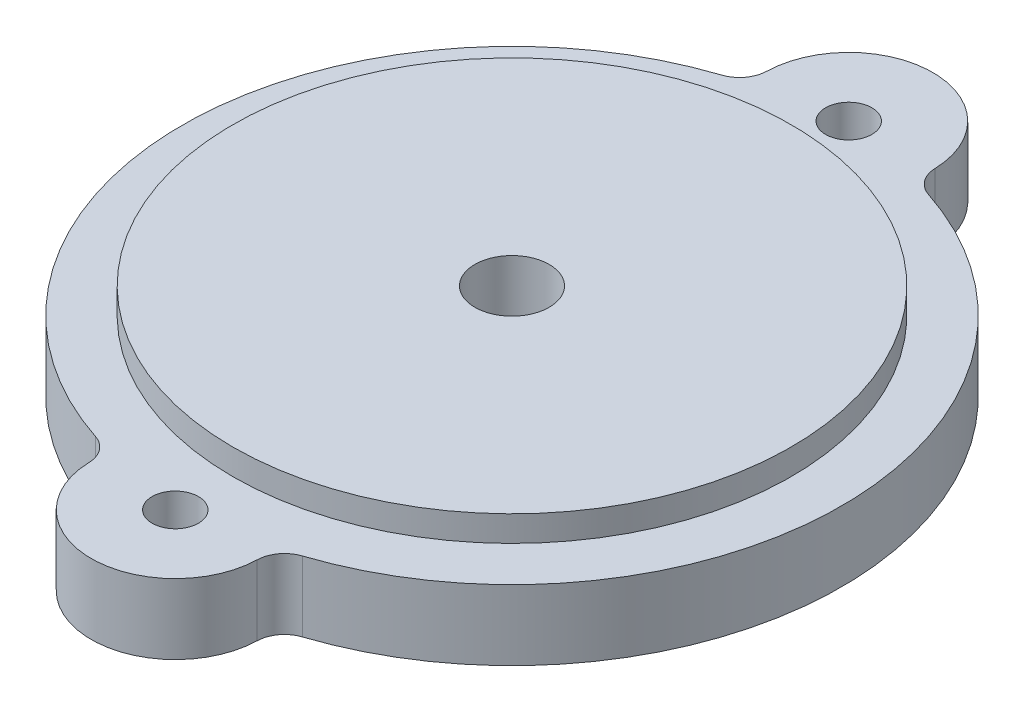
from build123d import *

# Parameters (mm, degrees)
SKETCH1_W           = 60
SKETCH1_H           = 60
SKETCH1_R           = 1.65
BOSS_EXTRUDE1_DEPTH = 5
SKETCH2_R           = 19.9
BOSS_EXTRUDE2_DEPTH = 1.83
SKETCH3_OUTSIDE_W   = 79.026
SKETCH3_OUTSIDE_H   = 79.026
CUT_EXTRUDE1_DEPTH  = 43.720018727
SKETCH4_R           = 2.65
CUT_EXTRUDE2_DEPTH  = 39.715615713
FILLET1_R           = 2


with BuildPart() as part:
    # Sketch1 → Boss-Extrude1 (new body)
    with BuildSketch(Plane(origin=(0, 0, 0), x_dir=(1, 0, 0), z_dir=(0, 1, 0))):
        Rectangle(SKETCH1_W, SKETCH1_H)
        with Locations(Location((0, 24, 0), (0, 0, 270))):
            Circle(SKETCH1_R, mode=Mode.SUBTRACT)
        with Locations(Location((0, -24, 0), (0, 0, 270))):
            Circle(SKETCH1_R, mode=Mode.SUBTRACT)
    extrude(amount=BOSS_EXTRUDE1_DEPTH)

    # Sketch2 → Boss-Extrude2 (add)
    with BuildSketch(Plane(origin=(0, 5, 0), x_dir=(1, 0, 0), z_dir=(0, 1, 0))):
        with Locations(Location((0, 0, 0), (0, 0, 270))):
            Circle(SKETCH2_R)
    extrude(amount=BOSS_EXTRUDE2_DEPTH)

    # Sketch3 outside → Cut-Extrude1 (cut, through all)
    with BuildSketch(Plane(origin=(0, 5, 0), x_dir=(1, 0, 0), z_dir=(0, 1, 0))):
        Rectangle(SKETCH3_OUTSIDE_W, SKETCH3_OUTSIDE_H)
        with BuildLine():
            ThreePointArc((5.869454294, -22.755208333), (23.5, 0), (5.869454294, 22.755208333))
            ThreePointArc((5.869454294, 22.755208333), (4.66201405, 27.776986232), (0, 30))
            ThreePointArc((0, 30), (-4.66201405, 27.776986232), (-5.869454294, 22.755208333))
            ThreePointArc((-5.869454294, 22.755208333), (-23.5, 0), (-5.869454294, -22.755208333))
            ThreePointArc((-5.869454294, -22.755208333), (-4.66201405, -27.776986232), (0, -30))
            ThreePointArc((0, -30), (4.66201405, -27.776986232), (5.869454294, -22.755208333))
        make_face(mode=Mode.SUBTRACT)
    extrude(amount=-CUT_EXTRUDE1_DEPTH, mode=Mode.SUBTRACT)

    # Sketch4 → Cut-Extrude2 (cut, through all)
    with BuildSketch(Plane.XZ):
        with Locations(Location((0, 0, 0), (0, 0, 270))):
            Circle(SKETCH4_R)
    extrude(amount=-CUT_EXTRUDE2_DEPTH, mode=Mode.SUBTRACT)

    # Fillet1
    fillet1_edges = [part.edges().sort_by_distance(p)[0] for p in [
        (5.869454294, 2.5, -22.755208333),
        (-5.869454294, 2.5, 22.755208333),
        (5.869454294, 2.5, 22.755208333),
        (-5.869454294, 2.5, -22.755208333),
    ]]
    fillet(fillet1_edges, radius=FILLET1_R)


solid = part.part
